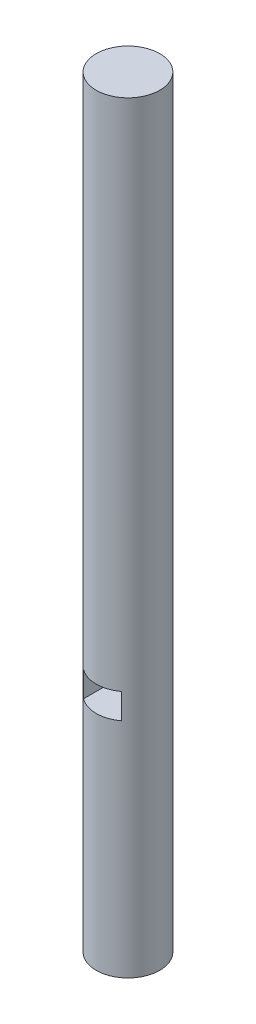
from build123d import *

# Parameters (mm, degrees)
SKETCH1_R           = 5
BOSS_EXTRUDE1_DEPTH = 120
SKETCH2_W           = 6
SKETCH2_H           = 4
CUT_EXTRUDE1_DEPTH  = 60


with BuildPart() as part:
    # Sketch1 → Boss-Extrude1 (new body)
    with BuildSketch(Plane(origin=(0, 0, 0), x_dir=(1, 0, 0), z_dir=(0, 1, 0))):
        with Locations(Location((0, 0, 0), (0, 0, 270))):
            Circle(SKETCH1_R)
    extrude(amount=BOSS_EXTRUDE1_DEPTH)

    # Sketch2 → Cut-Extrude1 (cut, symmetric)
    with BuildSketch(Plane.XY):
        with Locations((0, 37.032253422)):
            Rectangle(SKETCH2_W, SKETCH2_H)
    extrude(amount=CUT_EXTRUDE1_DEPTH, both=True, mode=Mode.SUBTRACT)


solid = part.part
